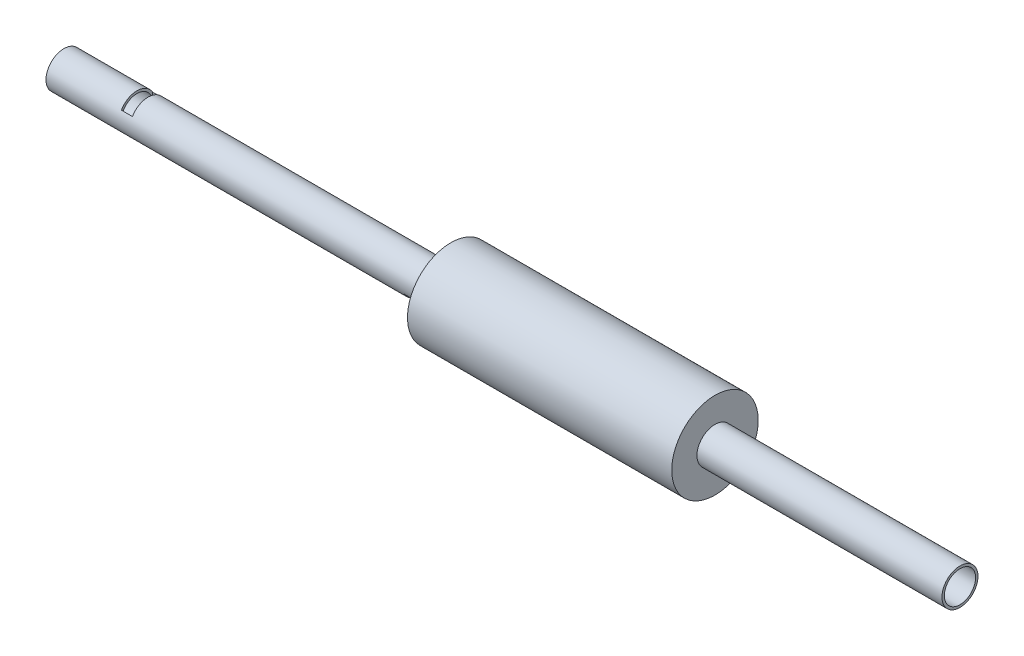
from build123d import *

# Parameters (mm, degrees)
CUT_EXTRUDE1_REACH = 219.495
SKETCH2_W          = 8
SKETCH2_H          = 13
CUT_EXTRUDE2_REACH = 219.495
SKETCH2_3_W        = 4.6
SKETCH2_3_H        = 13


with BuildPart() as part:
    # Sketch1 → Revolve1 (revolve)
    with BuildSketch(Plane.XY):
        Polygon((157, 6.5), (157, 7.5), (55, 7.5), (55, 18), (-55, 18), (-55, 7.5), (-216, 7.5), (-216, 6.5), align=None)
    revolve(axis=Axis((196.356223274, 0, 0), (-1, 0, 0)))

    # Sketch2 → Cut-Extrude1 (cut, up to next)
    with BuildSketch(Plane(origin=(0, 0, 0), x_dir=(1, 0, 0), z_dir=(0, 1, 0)), mode=Mode.PRIVATE) as cut_extrude1_sk1:
        with Locations((-64, 0)):
            Rectangle(SKETCH2_W, SKETCH2_H)
    cut_extrude1_tool1 = extrude(cut_extrude1_sk1.sketch, amount=-CUT_EXTRUDE1_REACH, mode=Mode.PRIVATE) & part.part
    add(cut_extrude1_tool1.solids().sort_by_distance((-64, 0, 0))[0], mode=Mode.SUBTRACT)

    # Sketch2<3> → Cut-Extrude2 (cut, up to next)
    with BuildSketch(Plane(origin=(0, 0, 0), x_dir=(1, 0, 0), z_dir=(0, 1, 0)), mode=Mode.PRIVATE) as cut_extrude2_sk1:
        with Locations((-183.3, 0)):
            Rectangle(SKETCH2_3_W, SKETCH2_3_H)
    cut_extrude2_tool1 = extrude(cut_extrude2_sk1.sketch, amount=CUT_EXTRUDE2_REACH, mode=Mode.PRIVATE) & part.part
    add(cut_extrude2_tool1.solids().sort_by_distance((-183.3, 0, 0))[0], mode=Mode.SUBTRACT)


solid = part.part
